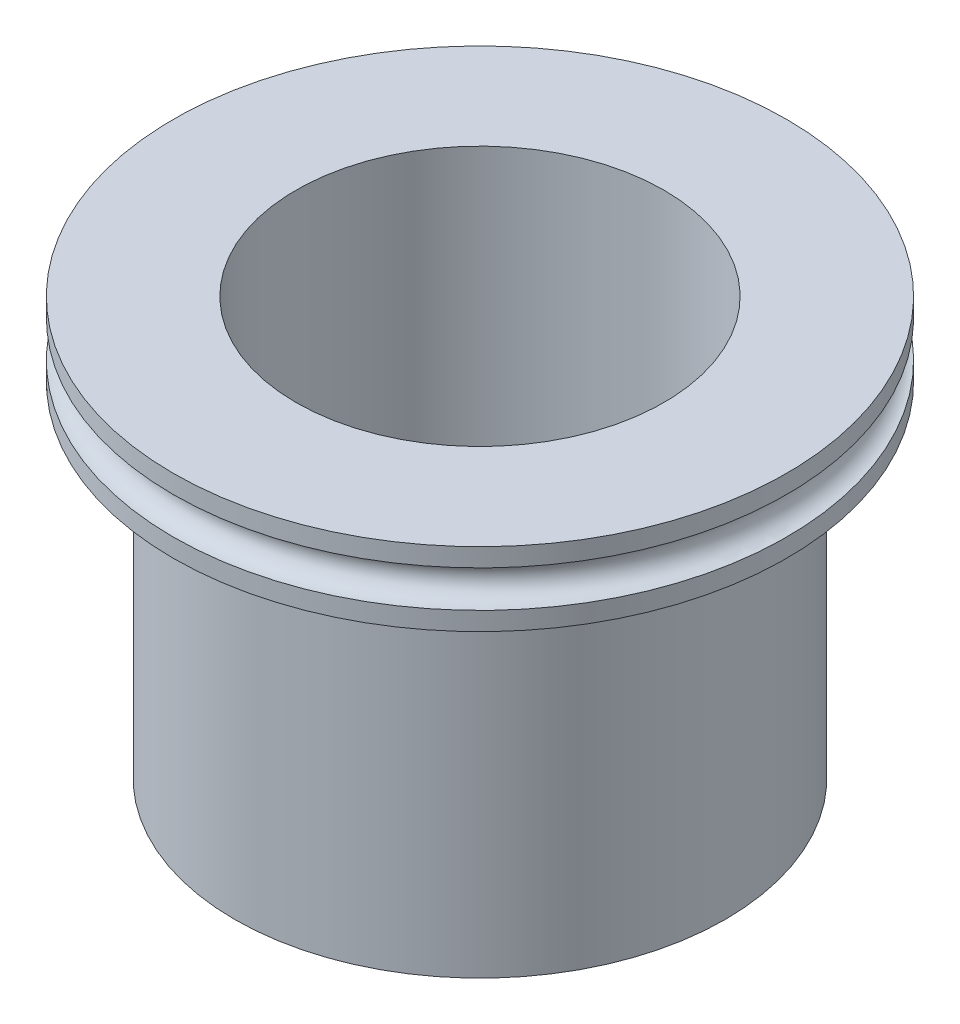
from build123d import *

# Parameters (mm, degrees)
CROQUIS1_R              = 12.5
SALIENTE_EXTRUIR1_DEPTH = 1.5
CROQUIS2_R              = 0.75
CROQUIS4_R              = 10
SALIENTE_EXTRUIR2_DEPTH = 14
CROQUIS3_R              = 7.5
CORTAR_EXTRUIR1_DEPTH   = 25.525496937


with BuildPart() as part:
    # Croquis1 → Saliente-Extruir1 (new, symmetric)
    with BuildSketch(Plane(origin=(0, 0, 0), x_dir=(1, 0, 0), z_dir=(0, 1, 0))):
        with Locations(Location((0, 0, 0), (0, 0, 270))):
            Circle(CROQUIS1_R)
    extrude(amount=SALIENTE_EXTRUIR1_DEPTH, both=True)

    # Croquis2 → Cortar-Revolución1 (revolve, cut)
    with BuildSketch(Plane(origin=(0, 0, 0), x_dir=(0, 0, -1), z_dir=(1, 0, 0)), mode=Mode.PRIVATE) as cortar_revoluci_n1_sk:
        with Locations((12.5, 0)):
            Circle(CROQUIS2_R)
    revolve(cortar_revoluci_n1_sk.sketch.rotate(Axis((0, 1.5, 0), (0, -1, 0)), 180), axis=Axis((0, 1.5, 0), (0, -1, 0)), mode=Mode.SUBTRACT)

    # Croquis4 → Saliente-Extruir2 (add)
    with BuildSketch(Plane.XZ.offset(1.5)):
        with Locations(Location((0, 0, 0), (0, 0, 90))):
            Circle(CROQUIS4_R)
    extrude(amount=SALIENTE_EXTRUIR2_DEPTH)

    # Croquis3 → Cortar-Extruir1 (cut, through all)
    with BuildSketch(Plane(origin=(0, 1.5, 0), x_dir=(1, 0, 0), z_dir=(0, 1, 0))):
        with Locations(Location((0, 0, 0), (0, 0, 270))):
            Circle(CROQUIS3_R)
    extrude(amount=-CORTAR_EXTRUIR1_DEPTH, mode=Mode.SUBTRACT)


solid = part.part
